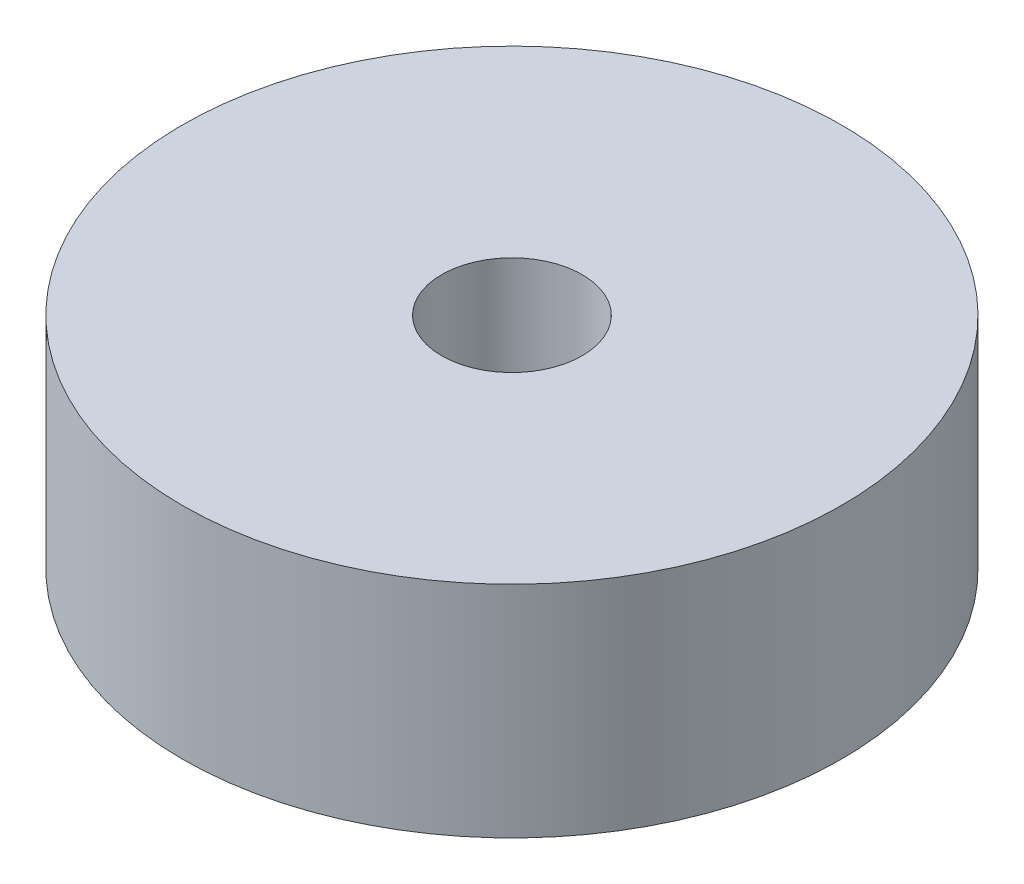
from build123d import *

# Parameters (mm, degrees)
SKETCH_1_R      = 7.5
SKETCH_1_R_2    = 1.6
EXTRUDE_1_DEPTH = 5


with BuildPart() as part:
    # ｽｹｯﾁ1 → ﾎﾞｽ - 押し出し1 (new body)
    with BuildSketch(Plane(origin=(0, 0, 0), x_dir=(1, 0, 0), z_dir=(0, 1, 0))):
        with Locations(Location((0, 0, 0), (0, 0, 270))):
            Circle(SKETCH_1_R)
        with Locations(Location((0, 0, 0), (0, 0, 270))):
            Circle(SKETCH_1_R_2, mode=Mode.SUBTRACT)
    extrude(amount=EXTRUDE_1_DEPTH)


solid = part.part
